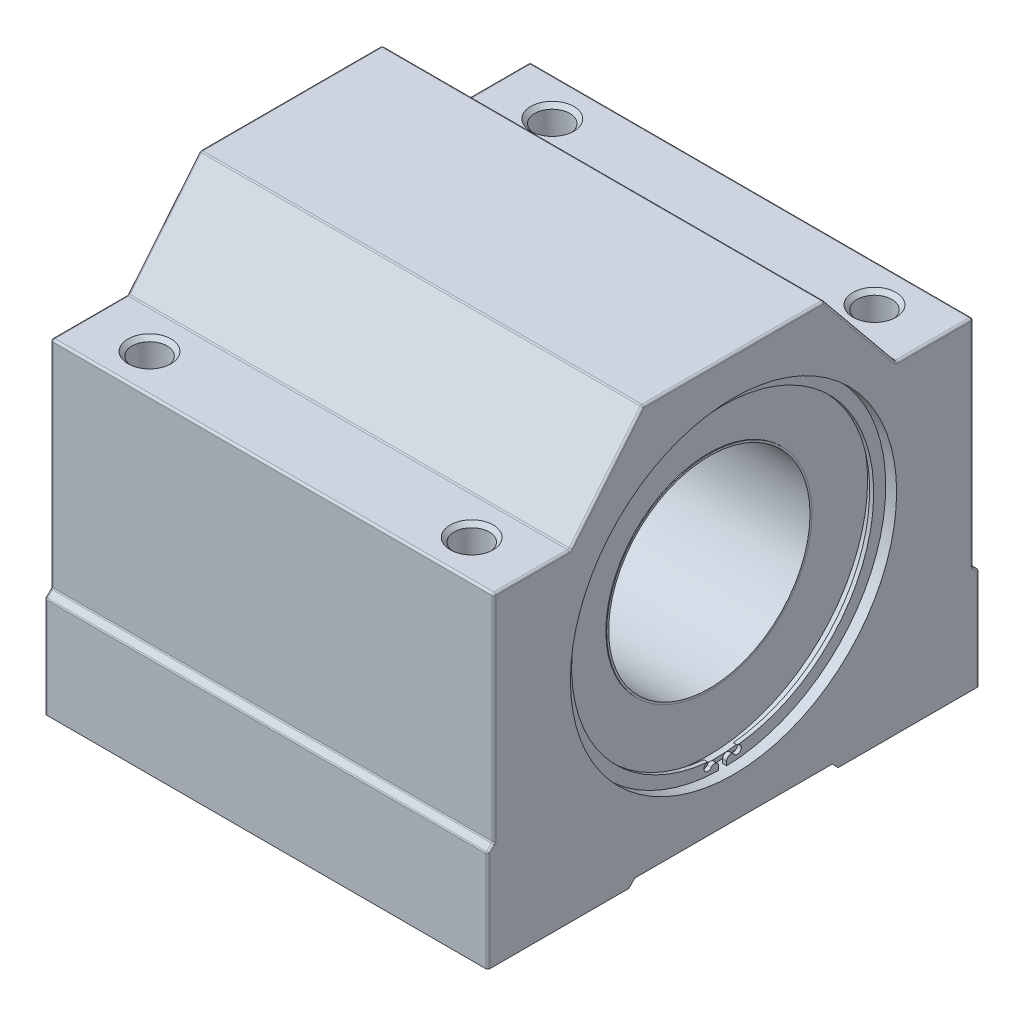
from build123d import *

# Parameters (mm, degrees)
SKETCH1_R           = 40.5
BOSS_EXTRUDE1_DEPTH = 110
EXTRUDE_THIN1_START = 0.5
SKETCH1_4_R         = 25.5
SKETCH1_4_R_2       = 25
EXTRUDE_THIN1_DEPTH = 103.5
BOSS_EXTRUDE2_START = 0.8
SKETCH1_5_R         = 39.5
SKETCH1_5_R_2       = 25
BOSS_EXTRUDE2_DEPTH = 103
BOSS_EXTRUDE3_START = 0.3
SKETCH1_6_R         = 40.5
SKETCH1_6_R_2       = 39.5
BOSS_EXTRUDE3_DEPTH = 105
BOSS_EXTRUDE4_START = 1
BOSS_EXTRUDE4_DEPTH = 1
FILLET1_R           = 0.5
SKETCH4_R           = 4.35
CUT_EXTRUDE3_DEPTH  = 162.941347407
CHAMFER1_SIZE       = 1


with BuildPart() as part:
    # Sketch1 → Boss-Extrude1 (new body)
    with BuildSketch(Plane(origin=(0, 0, 0), x_dir=(0, 0, -1), z_dir=(1, 0, 0))):
        Polygon((-61, -52), (-26, -52), (-24.5, -50.5), (24.5, -50.5), (26, -52), (61, -52), (61, -27), (59.5, -25.5), (59.5, 28), (40.5, 28), (22.5, 50), (-22.5, 50), (-40.5, 28), (-59.5, 28), (-59.5, -25.5), (-61, -27), align=None)
        Circle(SKETCH1_R, mode=Mode.SUBTRACT)
    extrude(amount=BOSS_EXTRUDE1_DEPTH)



with BuildPart() as body_2:
    # Sketch1<4> → Extrude-Thin1 (new body)
    with BuildSketch(Plane(origin=(0, 0, 0), x_dir=(0, 0, -1), z_dir=(1, 0, 0)).offset(EXTRUDE_THIN1_START)):
        Circle(SKETCH1_4_R)
        Circle(SKETCH1_4_R_2, mode=Mode.SUBTRACT)
    extrude(amount=EXTRUDE_THIN1_DEPTH)

    # Sketch1<5> → Boss-Extrude2 (add)
    with BuildSketch(Plane(origin=(0, 0, 0), x_dir=(0, 0, -1), z_dir=(1, 0, 0)).offset(BOSS_EXTRUDE2_START)):
        Circle(SKETCH1_5_R)
        Circle(SKETCH1_5_R_2, mode=Mode.SUBTRACT)
    extrude(amount=BOSS_EXTRUDE2_DEPTH)


with BuildPart() as part_1:
    add(part.part)

    add(body_2.part)  # Boss-Extrude3 merges body 2
    # Sketch1<6> → Boss-Extrude3 (add)
    with BuildSketch(Plane(origin=(0, 0, 0), x_dir=(0, 0, -1), z_dir=(1, 0, 0)).offset(BOSS_EXTRUDE3_START)):
        Circle(SKETCH1_6_R)
        Circle(SKETCH1_6_R_2, mode=Mode.SUBTRACT)
    extrude(amount=BOSS_EXTRUDE3_DEPTH)

    # Sketch3 → Boss-Extrude4 (add)
    with BuildSketch(Plane(origin=(105.3, 0, 0), x_dir=(0, 0, -1), z_dir=(1, 0, 0)).offset(BOSS_EXTRUDE4_START)):
        with BuildLine():
            Line((-1.000721761, -39.487321458), (-1.026056489, -40.487000483))
            ThreePointArc((-1.026056489, -40.487000483), (0, 40.5), (1.026056489, -40.487000483))
            Line((1.026056489, -40.487000483), (1.000721761, -39.487321458))
            ThreePointArc((1.000721761, -39.487321458), (1.688132242, -38.499209076), (2.827407683, -38.887732845))
            ThreePointArc((2.827407683, -38.887732845), (4.539151561, -38.792981705), (3.651791669, -37.326135665))
            ThreePointArc((3.651791669, -37.326135665), (0, 37.50434623), (-3.651791669, -37.326135665))
            ThreePointArc((-3.651791669, -37.326135665), (-4.539151561, -38.792981705), (-2.827407683, -38.887732845))
            ThreePointArc((-2.827407683, -38.887732845), (-1.688132242, -38.499209076), (-1.000721761, -39.487321458))
        make_face()
    extrude(amount=BOSS_EXTRUDE4_DEPTH)

    # Fillet1
    fillet1_edges = [part_1.edges().sort_by_distance(p)[0] for p in [
        (55, -25.5, -59.5),
        (55, -25.5, 59.5),
        (55, -27, 61),
        (55, -27, -61),
        (55, 28, -40.5),
        (55, 28, 40.5),
        (55, 50, 22.5),
        (55, 50, -22.5),
        (55, 28, -59.5),
        (55, 28, 59.5),
        (110, 39, -31.5),
        (110, 39, 31.5),
        (110, 1.25, 59.5),
        (0, -26.25, 60.25),
        (0, 39, 31.5),
        (110, -26.25, -60.25),
        (110, -39.5, -61),
        (110, 1.25, -59.5),
        (110, 50, 0),
        (110, 28, -50),
        (110, 28, 50),
        (110, -26.25, 60.25),
        (110, -39.5, 61),
        (0, -39.5, -61),
        (0, -26.25, -60.25),
        (0, 1.25, -59.5),
        (0, 39, -31.5),
        (0, 28, -50),
        (0, 50, 0),
        (0, -39.5, 61),
        (0, 1.25, 59.5),
        (0, 28, 50),
    ]]
    fillet(fillet1_edges, radius=FILLET1_R)

    # Sketch4 → Cut-Extrude3 (cut, through all)
    with BuildSketch(Plane.XZ.offset(52)):
        with Locations((15, 50)):
            Circle(SKETCH4_R)
        with Locations((95, 50)):
            Circle(SKETCH4_R)
        with Locations((95, -50)):
            Circle(SKETCH4_R)
        with Locations((15, -50)):
            Circle(SKETCH4_R)
    extrude(amount=-CUT_EXTRUDE3_DEPTH, mode=Mode.SUBTRACT)

    # Chamfer1
    chamfer1_edges = [part_1.edges().sort_by_distance(p)[0] for p in [
        (90.65, 28, -50),
        (10.65, 28, -50),
        (10.65, 28, 50),
        (90.65, 28, 50),
        (90.65, -52, 50),
        (10.65, -52, 50),
    ]]
    chamfer(chamfer1_edges, length=CHAMFER1_SIZE)


solid = part_1.part
